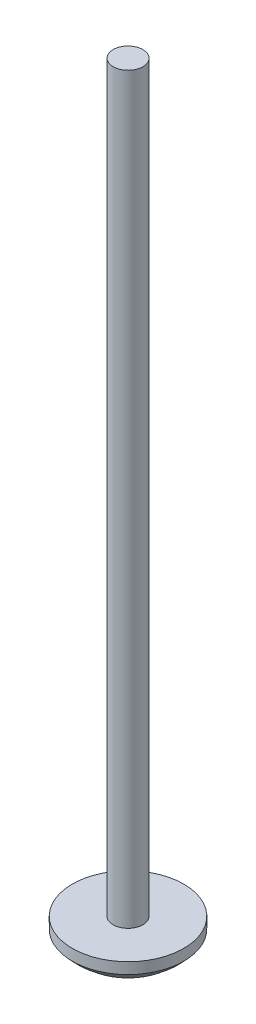
from build123d import *


with BuildPart() as part:
    # Sketch1 → Revolve1 (revolve)
    with BuildSketch(Plane.XY, mode=Mode.PRIVATE) as revolve1_sk:
        with BuildLine():
            Line((-1.5, 0.7), (-1.5, 1))
            Line((-1.5, 1), (-0.4, 1))
            Line((-0.4, 1), (-0.4, 21))
            Line((-0.4, 21), (0, 21))
            Line((0, 21), (0, 0))
            ThreePointArc((0, 0), (-0.827647268, 0.183612997), (-1.5, 0.7))
        make_face()
    revolve(revolve1_sk.sketch.rotate(Axis((0, 0, 0), (0, 1, 0)), 270), axis=Axis((0, 0, 0), (0, 1, 0)))


solid = part.part
